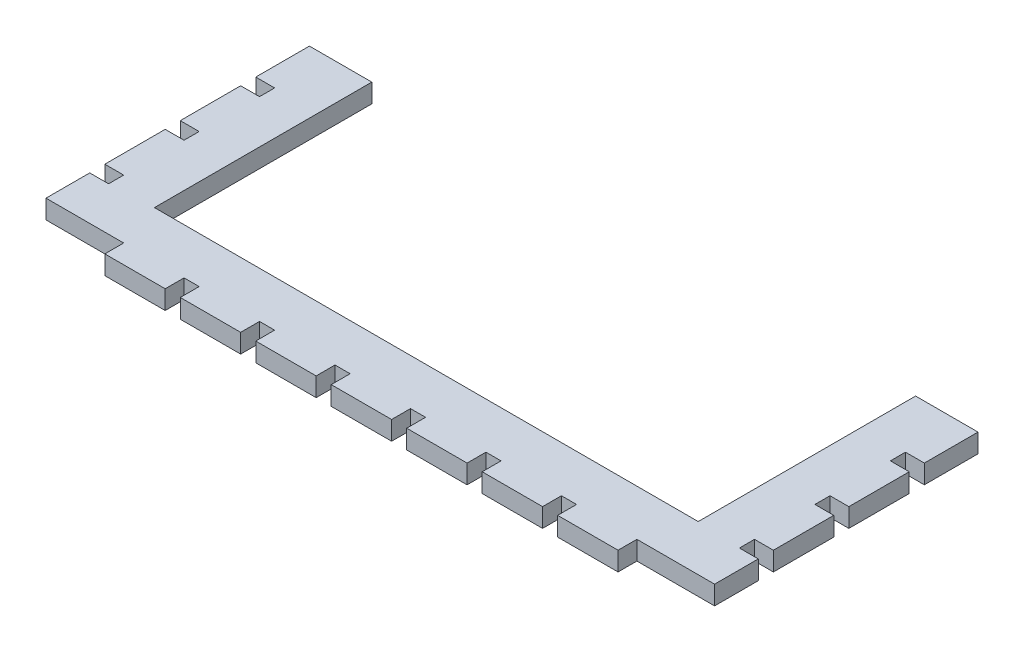
from build123d import *

# Parameters (mm, degrees)
SKETCH1_W           = 32.142857143
SKETCH1_H           = 6.35
SKETCH1_W_2         = 32.142857142
BOSS_EXTRUDE1_DEPTH = 6.35
SKETCH2_W           = 212.3
SKETCH2_H           = 112.5
CUT_EXTRUDE1_DEPTH  = 314.804310041
SKETCH3_W           = 212.3
SKETCH3_H           = 17.5
CUT_EXTRUDE2_DEPTH  = 6.35
SKETCH4_W           = 6.35
SKETCH4_H           = 18.05999894
SKETCH4_H_2         = 20.32
SKETCH4_H_3         = 14.71000106
BOSS_EXTRUDE2_DEPTH = 6.35
SKETCH5_W           = 183
SKETCH5_H           = 73.156
CUT_EXTRUDE3_DEPTH  = 245.316029969
SKETCH6_W           = 225
SKETCH6_H           = 6.35
BOSS_EXTRUDE3_DEPTH = 6.35
SKETCH7_W           = 5.08
SKETCH7_H           = 6.35
SKETCH7_W_2         = 26.14
CUT_EXTRUDE4_DEPTH  = 245.316029969


with BuildPart() as part:
    # Sketch1 → Boss-Extrude1 (new body)
    with BuildSketch(Plane(origin=(0, 0, 0), x_dir=(1, 0, 0), z_dir=(0, 1, 0))):
        Polygon((6.35, 6.35), (32.142857143, 6.35), (64.285714286, 6.35), (96.428571429, 6.35), (128.571428571, 6.35), (160.714285714, 6.35), (192.857142857, 6.35), (218.65, 6.35), (218.65, 32.142857143), (218.65, 64.285714286), (218.65, 96.428571429), (218.65, 128.571428571), (218.65, 160.714285714), (218.65, 192.857142857), (218.65, 218.65), (192.857142857, 218.65), (160.714285714, 218.65), (128.571428571, 218.65), (96.428571429, 218.65), (64.285714286, 218.65), (32.142857143, 218.65), (6.35, 218.65), (6.35, 192.857142857), (6.35, 160.714285714), (6.35, 128.571428571), (6.35, 96.428571429), (6.35, 64.285714286), (6.35, 32.142857143), align=None)
        with Locations((48.214285715, 221.825)):
            Rectangle(SKETCH1_W, SKETCH1_H)
        with Locations((112.5, 221.825)):
            Rectangle(SKETCH1_W_2, SKETCH1_H)
        with Locations((176.785714286, 221.825)):
            Rectangle(SKETCH1_W, SKETCH1_H)
        with Locations((176.785714286, 3.175)):
            Rectangle(SKETCH1_W, SKETCH1_H)
        with Locations((112.5, 3.175)):
            Rectangle(SKETCH1_W_2, SKETCH1_H)
        with Locations((48.214285715, 3.175)):
            Rectangle(SKETCH1_W, SKETCH1_H)
    extrude(amount=BOSS_EXTRUDE1_DEPTH)

    # Sketch2 → Cut-Extrude1 (cut, through all)
    with BuildSketch(Plane(origin=(0, 6.35, 0), x_dir=(1, 0, 0), z_dir=(0, 1, 0))):
        with Locations((112.5, 168.75)):
            Rectangle(SKETCH2_W, SKETCH2_H)
    extrude(amount=-CUT_EXTRUDE1_DEPTH, mode=Mode.SUBTRACT)

    # Sketch3 → Cut-Extrude2 (cut)
    with BuildSketch(Plane(origin=(0, 6.35, 0), x_dir=(1, 0, 0), z_dir=(0, 1, 0))):
        with Locations((112.5, 103.75)):
            Rectangle(SKETCH3_W, SKETCH3_H)
    extrude(amount=-CUT_EXTRUDE2_DEPTH, mode=Mode.SUBTRACT)

    # Sketch4 → Boss-Extrude2 (add)
    with BuildSketch(Plane(origin=(0, 6.35, 0), x_dir=(1, 0, 0), z_dir=(0, 1, 0))):
        with Locations((3.175, 85.97000053)):
            Rectangle(SKETCH4_W, SKETCH4_H)
        with Locations((3.175, 61.70000106)):
            Rectangle(SKETCH4_W, SKETCH4_H_2)
        with Locations((3.175, 36.30000106)):
            Rectangle(SKETCH4_W, SKETCH4_H_2)
        with Locations((3.175, 13.70500053)):
            Rectangle(SKETCH4_W, SKETCH4_H_3)
        with Locations((221.825, 85.97000053)):
            Rectangle(SKETCH4_W, SKETCH4_H)
        with Locations((221.825, 61.70000106)):
            Rectangle(SKETCH4_W, SKETCH4_H_2)
        with Locations((221.825, 36.30000106)):
            Rectangle(SKETCH4_W, SKETCH4_H_2)
        with Locations((221.825, 13.70500053)):
            Rectangle(SKETCH4_W, SKETCH4_H_3)
    extrude(amount=-BOSS_EXTRUDE2_DEPTH)

    # Sketch5 → Cut-Extrude3 (cut, through all)
    with BuildSketch(Plane.XZ):
        with Locations((112.5, -58.422)):
            Rectangle(SKETCH5_W, SKETCH5_H)
    extrude(amount=-CUT_EXTRUDE3_DEPTH, mode=Mode.SUBTRACT)

    # Sketch6 → Boss-Extrude3 (add)
    with BuildSketch(Plane.XZ):
        with Locations((112.5, -3.175)):
            Rectangle(SKETCH6_W, SKETCH6_H)
    extrude(amount=-BOSS_EXTRUDE3_DEPTH)

    # Sketch7 → Cut-Extrude4 (cut, through all)
    with BuildSketch(Plane.XZ):
        with Locations((176, -3.175)):
            Rectangle(SKETCH7_W, SKETCH7_H)
        with Locations((150.6, -3.175)):
            Rectangle(SKETCH7_W, SKETCH7_H)
        with Locations((125.2, -3.175)):
            Rectangle(SKETCH7_W, SKETCH7_H)
        with Locations((99.8, -3.175)):
            Rectangle(SKETCH7_W, SKETCH7_H)
        with Locations((74.4, -3.175)):
            Rectangle(SKETCH7_W, SKETCH7_H)
        with Locations((49, -3.175)):
            Rectangle(SKETCH7_W, SKETCH7_H)
        with Locations((211.93, -3.175)):
            Rectangle(SKETCH7_W_2, SKETCH7_H)
        with Locations((13.07, -3.175)):
            Rectangle(SKETCH7_W_2, SKETCH7_H)
    extrude(amount=-CUT_EXTRUDE4_DEPTH, mode=Mode.SUBTRACT)


solid = part.part
